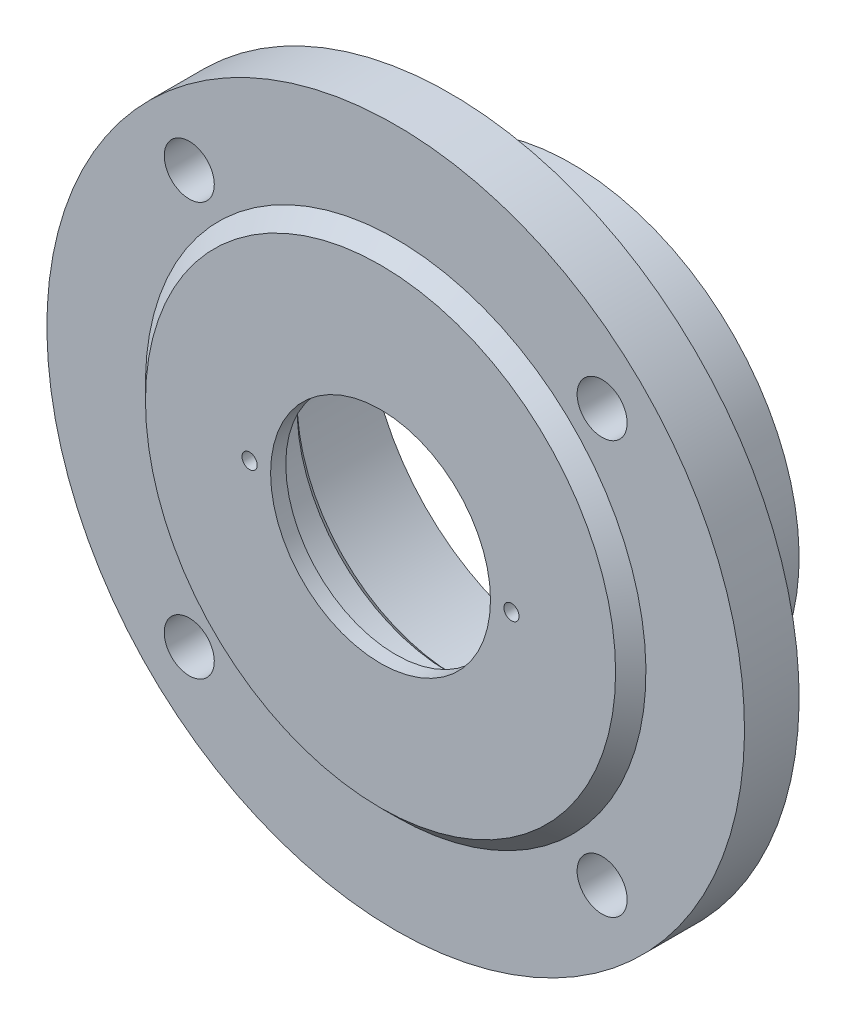
from build123d import *

# Parameters (mm, degrees)
M6_CLEARANCE_HOLE1_D = 6.6
CIRPATTERN1_COUNT    = 4
CUT_EXTRUDE1_REACH   = 71.764
SKETCH5_R            = 1


with BuildPart() as part:
    # Sketch1 → Revolve1 (revolve)
    with BuildSketch(Plane(origin=(0, 0, 0), x_dir=(0, 0, -1), z_dir=(1, 0, 0)), mode=Mode.PRIVATE) as revolve1_sk:
        with BuildLine():
            Line((0, 14.5), (0, 31))
            Line((0, 31), (2, 33))
            Line((2, 33), (2, 46))
            Line((2, 46), (9.2, 46))
            Line((9.2, 46), (9.2, 31))
            Line((9.2, 31), (14.2, 31))
            ThreePointArc((14.2, 31), (14.492893219, 30.292893219), (15.2, 30))
            Line((15.2, 30), (25.2, 30))
            Line((25.2, 30), (25.2, 27))
            Line((25.2, 27), (11, 27))
            ThreePointArc((11, 27), (10.292893219, 26.707106781), (10, 26))
            Line((10, 26), (10, 21))
            Line((10, 21), (9, 20))
            Line((9, 20), (2, 20))
            Line((2, 20), (2, 14.5))
            Line((2, 14.5), (0, 14.5))
        make_face()
    revolve(revolve1_sk.sketch.rotate(Axis((0, 0, 0), (0, 0, -1)), 180), axis=Axis((0, 0, 0), (0, 0, -1)))

    # M6 Clearance Hole1 (through all)
    with Locations(Plane.XY.offset(-2)):
        with Locations((27.223611076, 27.223611076)):
            m6_clearance_hole1 = Hole(M6_CLEARANCE_HOLE1_D / 2)

    # CirPattern1: M6 Clearance Hole1 ×4 about axis
    cirpattern1_axis = Axis((0, 0, 0), (0, 0, 1))
    for i in range(1, CIRPATTERN1_COUNT):
        add(m6_clearance_hole1.rotate(cirpattern1_axis, i * 360 / CIRPATTERN1_COUNT), mode=Mode.SUBTRACT)

    # Sketch5 → Cut-Extrude1 (cut, up to next)
    with BuildSketch(Plane.XY, mode=Mode.PRIVATE) as cut_extrude1_sk1:
        with Locations((17.27, 0)):
            Circle(SKETCH5_R)
    cut_extrude1_tool1 = extrude(cut_extrude1_sk1.sketch, amount=-CUT_EXTRUDE1_REACH, mode=Mode.PRIVATE) & part.part
    # Sketch5 → Cut-Extrude1 (cut, up to next)
    with BuildSketch(Plane.XY, mode=Mode.PRIVATE) as cut_extrude1_sk2:
        with Locations(Location((-17.27, 0, 0), (0, 0, 270))):
            Circle(SKETCH5_R)
    cut_extrude1_tool2 = extrude(cut_extrude1_sk2.sketch, amount=-CUT_EXTRUDE1_REACH, mode=Mode.PRIVATE) & part.part
    add(cut_extrude1_tool1.solids().sort_by_distance((17.27, 0, 0))[0], mode=Mode.SUBTRACT)
    add(cut_extrude1_tool2.solids().sort_by_distance((-17.27, 0, 0))[0], mode=Mode.SUBTRACT)


solid = part.part
